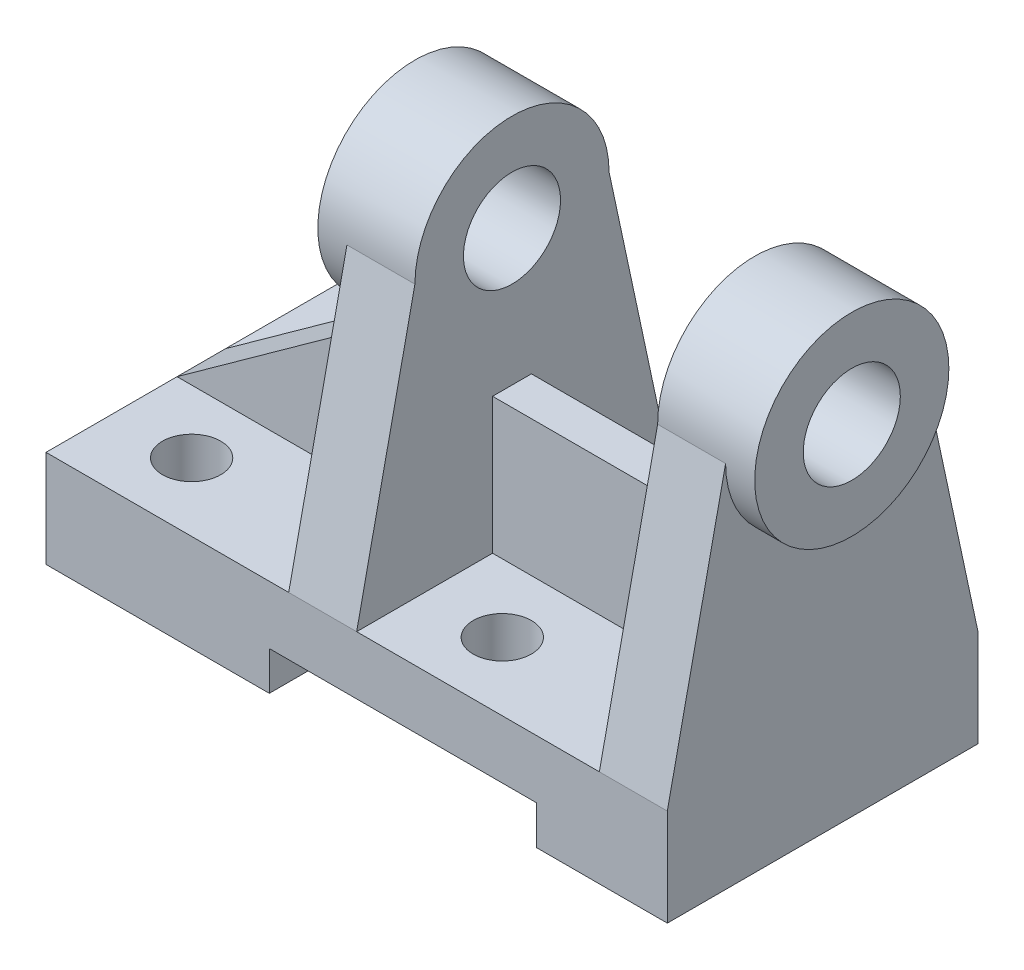
from build123d import *

# Parameters (mm, degrees)
SKETCH1_W           = 128
SKETCH1_H           = 64
BOSS_EXTRUDE1_DEPTH = 20
SKETCH2_W           = 55
SKETCH2_H           = 8
CUT_EXTRUDE1_DEPTH  = 93.69304181
SKETCH4_R           = 10
BOSS_EXTRUDE3_DEPTH = 14
BOSS_EXTRUDE4_START = 6
SKETCH4_3_R         = 10
BOSS_EXTRUDE4_DEPTH = 6
SKETCH18_W          = 50
SKETCH18_H          = 8
BOSS_EXTRUDE6_DEPTH = 28
RIB1_REACH          = 125.045
SKETCH19_WALL_W     = 309.701101848
SKETCH19_WALL_H     = 10
SKETCH20_R          = 6
CUT_EXTRUDE2_DEPTH  = 109.166538264
SKETCH21_R          = 6
CUT_EXTRUDE3_DEPTH  = 109.166538264
SKETCH22_R          = 6
CUT_EXTRUDE4_DEPTH  = 109.166538264


with BuildPart() as part:
    # Sketch1 → Boss-Extrude1 (new body)
    with BuildSketch(Plane(origin=(0, 0, 0), x_dir=(1, 0, 0), z_dir=(0, 1, 0))):
        Rectangle(SKETCH1_W, SKETCH1_H)
    extrude(amount=BOSS_EXTRUDE1_DEPTH)

    # Sketch2 → Cut-Extrude1 (cut, through all)
    with BuildSketch(Plane.XY.offset(32)):
        with Locations((9.5, 4)):
            Rectangle(SKETCH2_W, SKETCH2_H)
    extrude(amount=-CUT_EXTRUDE1_DEPTH, mode=Mode.SUBTRACT)

    # Sketch4 → Boss-Extrude3 (add)
    with BuildSketch(Plane(origin=(64, 0, 0), x_dir=(0, 0, -1), z_dir=(1, 0, 0))):
        with BuildLine():
            Line((32, 20), (20, 76))
            ThreePointArc((20, 76), (0, 96), (-20, 76))
            Line((-20, 76), (-32, 20))
            Line((-32, 20), (32, 20))
        make_face()
        with Locations((0, 76)):
            Circle(SKETCH4_R, mode=Mode.SUBTRACT)
    boss_extrude3 = extrude(amount=-BOSS_EXTRUDE3_DEPTH)

    # Sketch4<3> → Boss-Extrude4 (add)
    with BuildSketch(Plane(origin=(64, 0, 0), x_dir=(0, 0, -1), z_dir=(1, 0, 0)).offset(BOSS_EXTRUDE4_START)):
        with BuildLine():
            ThreePointArc((-20, 76), (0, 56), (20, 76))
            ThreePointArc((20, 76), (0, 96), (-20, 76))
        make_face()
        with Locations((0, 76)):
            Circle(SKETCH4_3_R, mode=Mode.SUBTRACT)
    boss_extrude4 = extrude(amount=-BOSS_EXTRUDE4_DEPTH)

    # Mirror2: Boss-Extrude3, Boss-Extrude4 across plane
    add(boss_extrude3.mirror(Plane.ZY.offset(-25)))
    add(boss_extrude4.mirror(Plane.ZY.offset(-25)))

    # Sketch18 → Boss-Extrude6 (add)
    with BuildSketch(Plane(origin=(0, 20, 0), x_dir=(1, 0, 0), z_dir=(0, 1, 0))):
        with Locations((25, 0)):
            Rectangle(SKETCH18_W, SKETCH18_H)
    extrude(amount=BOSS_EXTRUDE6_DEPTH)

    # Sketch19 wall → Rib1 (add, up to next)
    with BuildSketch(Plane(origin=(-39, 38, 0), x_dir=(0.811534341451, 0.584304725845, 0), z_dir=(-0.584304725845, 0.811534341451, 0)), mode=Mode.PRIVATE) as rib1_sk1:
        Rectangle(SKETCH19_WALL_W, SKETCH19_WALL_H)
    rib1_tool1 = extrude(rib1_sk1.sketch, amount=-RIB1_REACH, mode=Mode.PRIVATE) - part.part
    add(rib1_tool1.solids().sort_by_distance((-39, 38, 0))[0])

    # Sketch20 → Cut-Extrude2 (cut, through all)
    with BuildSketch(Plane(origin=(0, 20, 0), x_dir=(1, 0, 0), z_dir=(0, 1, 0))):
        with Locations((16, -18)):
            Circle(SKETCH20_R)
    extrude(amount=-CUT_EXTRUDE2_DEPTH, mode=Mode.SUBTRACT)

    # Sketch21 → Cut-Extrude3 (cut, through all)
    with BuildSketch(Plane(origin=(0, 20, 0), x_dir=(1, 0, 0), z_dir=(0, 1, 0))):
        with Locations((16, 18)):
            Circle(SKETCH21_R)
    extrude(amount=-CUT_EXTRUDE3_DEPTH, mode=Mode.SUBTRACT)

    # Sketch22 → Cut-Extrude4 (cut, through all)
    with BuildSketch(Plane(origin=(0, 20, 0), x_dir=(1, 0, 0), z_dir=(0, 1, 0))):
        with Locations((-48, -18)):
            Circle(SKETCH22_R)
        with Locations((-48, 18)):
            Circle(SKETCH22_R)
    extrude(amount=-CUT_EXTRUDE4_DEPTH, mode=Mode.SUBTRACT)


solid = part.part
